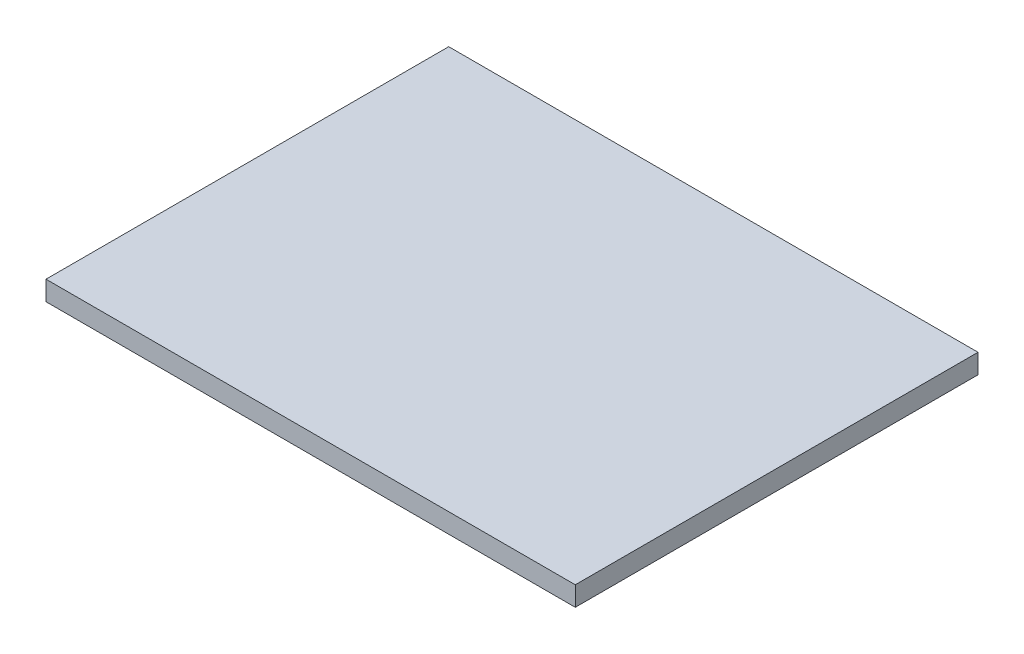
from build123d import *

# Parameters (mm, degrees)
SKETCH2_W           = 68.801304246
SKETCH2_H           = 52.348818448
BOSS_EXTRUDE1_DEPTH = 2.54


with BuildPart() as part:
    # Sketch2 → Boss-Extrude1 (new body)
    with BuildSketch(Plane(origin=(0, 0, 0), x_dir=(1, 0, 0), z_dir=(0, 1, 0))):
        with Locations((34.400652123, 26.174409224)):
            Rectangle(SKETCH2_W, SKETCH2_H)
    extrude(amount=BOSS_EXTRUDE1_DEPTH)


solid = part.part
